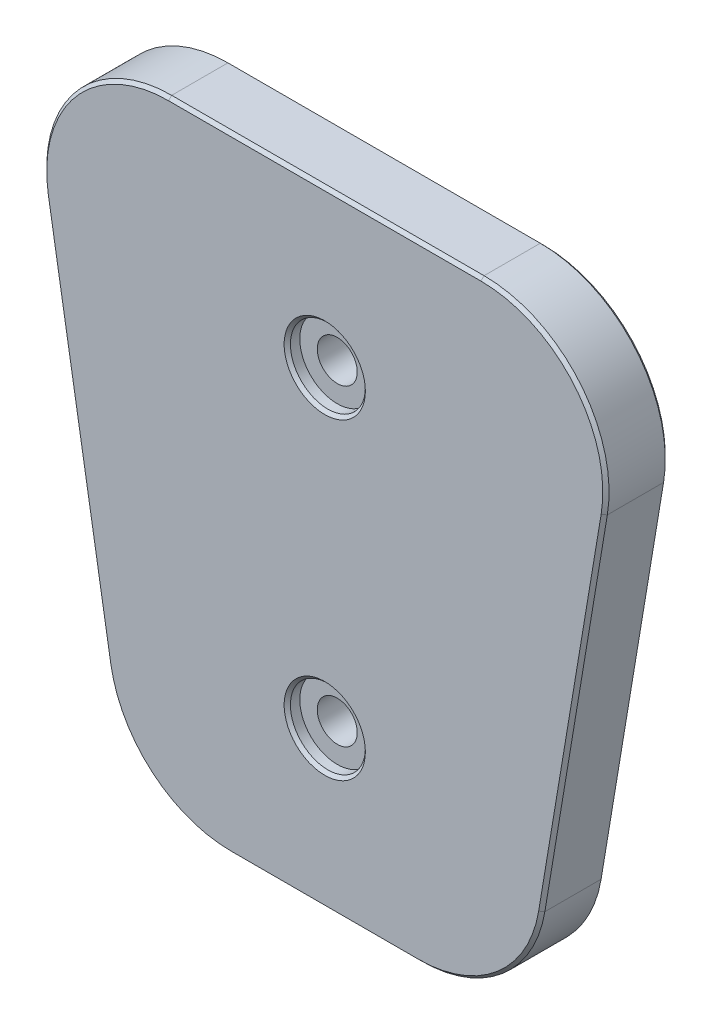
from build123d import *

# Parameters (mm, degrees)
BOSS_EXTRUDE1_DEPTH = 10
SKETCH4_R           = 6
CUT_EXTRUDE1_DEPTH  = 2
SKETCH5_R           = 3.2
CUT_EXTRUDE2_DEPTH  = 131.441517879
CHAMFER1_SIZE       = 0.5


with BuildPart() as part:
    # Sketch3 → Boss-Extrude1 (new body)
    with BuildSketch(Plane.XY):
        with BuildLine():
            Line((-6.355283539, -23.287979746), (3.644716461, -83.287979746))
            ThreePointArc((3.644716461, -83.287979746), (10.445097015, -95.260399649), (23.372594937, -100))
            Line((23.372594937, -100), (53.372594937, -100))
            ThreePointArc((53.372594937, -100), (66.30009286, -95.260399649), (73.100473414, -83.287979746))
            Line((73.100473414, -83.287979746), (83.100473414, -23.287979746))
            ThreePointArc((83.100473414, -23.287979746), (78.632994587, -7.072502077), (63.372594937, 0))
            Line((63.372594937, 0), (13.372594937, 0))
            ThreePointArc((13.372594937, 0), (-1.887804712, -7.072502077), (-6.355283539, -23.287979746))
        make_face()
    extrude(amount=BOSS_EXTRUDE1_DEPTH)

    # Sketch4 → Cut-Extrude1 (cut)
    with BuildSketch(Plane.XY.offset(10)):
        with Locations((38.372594937, -25)):
            Circle(SKETCH4_R)
        with Locations((38.372594937, -75)):
            Circle(SKETCH4_R)
    extrude(amount=-CUT_EXTRUDE1_DEPTH, mode=Mode.SUBTRACT)

    # Sketch5 → Cut-Extrude2 (cut, through all)
    with BuildSketch(Plane.XY.offset(8)):
        with Locations((38.372594937, -25)):
            Circle(SKETCH5_R)
        with Locations((38.372594937, -75)):
            Circle(SKETCH5_R)
    extrude(amount=-CUT_EXTRUDE2_DEPTH, mode=Mode.SUBTRACT)

    # Chamfer1
    chamfer1_edges = [part.edges().sort_by_distance(p)[0] for p in [
        (66.30009286, -95.260399649, 0),
        (38.372594937, -100, 0),
        (10.445097015, -95.260399649, 0),
        (-1.355283539, -53.287979746, 0),
        (38.372594937, -100, 10),
        (66.30009286, -95.260399649, 10),
        (78.100473414, -53.287979746, 10),
        (78.632994587, -7.072502077, 10),
        (32.372594937, -25, 10),
        (32.372594937, -75, 10),
        (38.372594937, 0, 10),
        (-1.887804712, -7.072502077, 10),
        (35.172594937, -25, 0),
        (35.172594937, -75, 0),
        (-1.355283539, -53.287979746, 10),
        (-1.887804712, -7.072502077, 0),
        (10.445097015, -95.260399649, 10),
        (38.372594937, 0, 0),
        (78.632994587, -7.072502077, 0),
        (78.100473414, -53.287979746, 0),
    ]]
    chamfer(chamfer1_edges, length=CHAMFER1_SIZE)


solid = part.part
